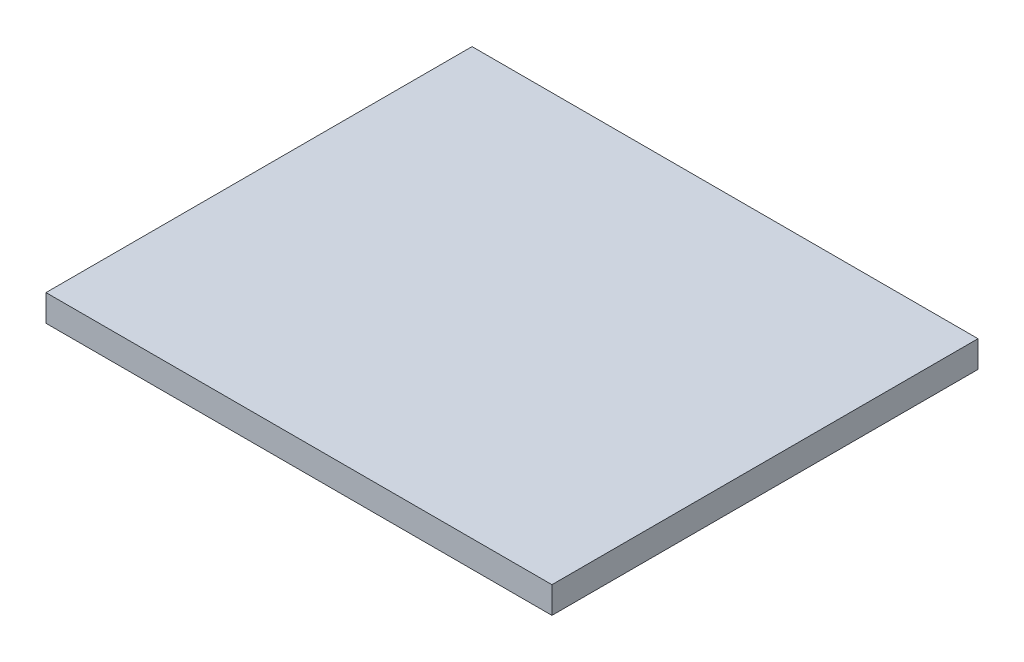
from build123d import *

# Parameters (mm, degrees)
SKETCH1_W           = 19
SKETCH1_H           = 16
BOSS_EXTRUDE1_DEPTH = 1


with BuildPart() as part:
    # Sketch1 → Boss-Extrude1 (new body)
    with BuildSketch(Plane(origin=(0, 0, 0), x_dir=(1, 0, 0), z_dir=(0, 1, 0))):
        Rectangle(SKETCH1_W, SKETCH1_H)
    extrude(amount=BOSS_EXTRUDE1_DEPTH)


solid = part.part
